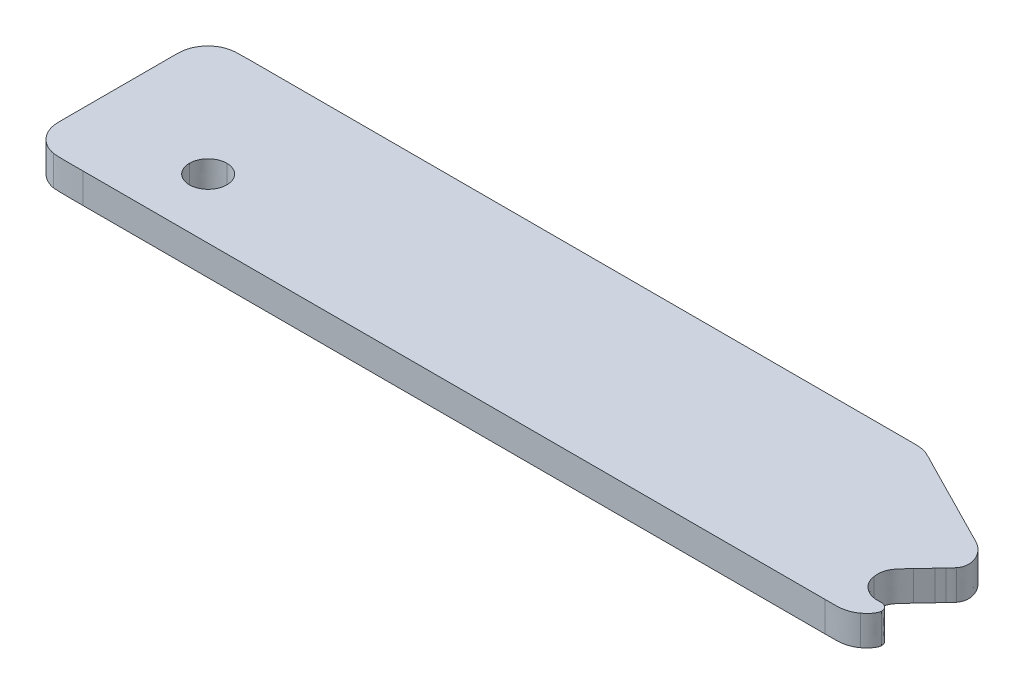
from build123d import *

# Parameters (mm, degrees)
BOSS_EXTRUDE1_DEPTH = 6.35


with BuildPart() as part:
    # Sketch1 → Boss-Extrude1 (new body)
    with BuildSketch(Plane(origin=(0, 0, 0), x_dir=(1, 0, 0), z_dir=(0, 1, 0))):
        with BuildLine():
            add(Edge.make_bspline(
                [(174.840646, 5.6295036), (175.391826, 5.627243), (175.9154724, 5.730748), (176.4597944, 5.4342538)],
                knots=[0, 0, 0, 0, 1, 1, 1, 1], degree=3))
            add(Edge.make_bspline(
                [(176.4597944, 5.4342538), (177.0317008, 5.1242468), (177.2659396, 4.7452534), (177.2866152, 4.0906446)],
                knots=[0, 0, 0, 0, 1, 1, 1, 1], degree=3))
            add(Edge.make_bspline(
                [(177.2866152, 4.0906446), (177.3141234, 3.1260542), (176.0808518, 1.947799), (175.4538274, 1.4862048)],
                knots=[0, 0, 0, 0, 1, 1, 1, 1], degree=3))
            add(Edge.make_bspline(
                [(175.4538274, 1.4862048), (173.407451, -0.0296672), (171.3541658, 0.2390394), (169.1217598, 0.2390394)],
                knots=[0, 0, 0, 0, 1, 1, 1, 1], degree=3))
            add(Edge.make_bspline(
                [(169.1217598, 0.2390394), (164.7602496, 0.2390394), (160.3987648, 0.2390394), (156.0441634, 0.2390394)],
                knots=[0, 0, 0, 0, 1, 1, 1, 1], degree=3))
            add(Edge.make_bspline(
                [(156.0441634, 0.2390394), (147.3211938, 0.2390394), (138.5981988, 0.2390394), (129.8821126, 0.2390394)],
                knots=[0, 0, 0, 0, 1, 1, 1, 1], degree=3))
            add(Edge.make_bspline(
                [(129.8821126, 0.2390394), (112.3879134, 0.2390394), (94.8937142, 0.2390394), (77.3926316, 0.2390394)],
                knots=[0, 0, 0, 0, 1, 1, 1, 1], degree=3))
            add(Edge.make_bspline(
                [(77.3926316, 0.2390394), (59.8846656, 0.2390394), (42.383583, 0.2390394), (24.8755916, 0.2390394)],
                knots=[0, 0, 0, 0, 1, 1, 1, 1], degree=3))
            add(Edge.make_bspline(
                [(24.8755916, 0.2390394), (20.527899, 0.2390394), (16.180181, 0.2390394), (11.8393464, 0.2390394)],
                knots=[0, 0, 0, 0, 1, 1, 1, 1], degree=3))
            add(Edge.make_bspline(
                [(11.8393464, 0.2390394), (11.0194344, 0.2390394), (6.2100714, 0.1990344), (5.3832506, 0.3495548)],
                knots=[0, 0, 0, 0, 1, 1, 1, 1], degree=3))
            add(Edge.make_bspline(
                [(5.3832506, 0.3495548), (3.0681422, 0.7975346), (1.1940032, 2.4785828), (0.5050028, 4.724781)],
                knots=[0, 0, 0, 0, 1, 1, 1, 1], degree=3))
            add(Edge.make_bspline(
                [(0.5050028, 4.724781), (0.1811528, 5.7858914), (0.222504, 6.8331842), (0.222504, 7.9080868)],
                knots=[0, 0, 0, 0, 1, 1, 1, 1], degree=3))
            add(Edge.make_bspline(
                [(0.222504, 7.9080868), (0.222504, 8.9898474), (0.222504, 10.0784914), (0.222504, 11.160252)],
                knots=[0, 0, 0, 0, 1, 1, 1, 1], degree=3))
            add(Edge.make_bspline(
                [(0.222504, 11.160252), (0.222504, 13.33754), (0.222504, 15.5079446), (0.222504, 17.6784)],
                knots=[0, 0, 0, 0, 1, 1, 1, 1], degree=3))
            add(Edge.make_bspline(
                [(0.222504, 17.6784), (0.222504, 22.0260926), (0.222504, 26.3737852), (0.222504, 30.7215032)],
                knots=[0, 0, 0, 0, 1, 1, 1, 1], degree=3))
            add(Edge.make_bspline(
                [(0.222504, 30.7215032), (0.222504, 31.796355), (0.194945, 32.8436986), (0.5325618, 33.9047328)],
                knots=[0, 0, 0, 0, 1, 1, 1, 1], degree=3))
            add(Edge.make_bspline(
                [(0.5325618, 33.9047328), (0.9115044, 35.0691958), (1.5109698, 35.9580434), (2.4411432, 36.7641886)],
                knots=[0, 0, 0, 0, 1, 1, 1, 1], degree=3))
            add(Edge.make_bspline(
                [(2.4411432, 36.7641886), (4.3979592, 38.4453892), (6.42366, 38.2938528), (8.6905338, 38.2938528)],
                knots=[0, 0, 0, 0, 1, 1, 1, 1], degree=3))
            add(Edge.make_bspline(
                [(8.6905338, 38.2938528), (13.0451352, 38.2938528), (17.3997366, 38.2938528), (21.754338, 38.2938528)],
                knots=[0, 0, 0, 0, 1, 1, 1, 1], degree=3))
            add(Edge.make_bspline(
                [(21.754338, 38.2938528), (30.4635408, 38.2938528), (39.1658602, 38.2938528), (47.875063, 38.2938528)],
                knots=[0, 0, 0, 0, 1, 1, 1, 1], degree=3))
            add(Edge.make_bspline(
                [(47.875063, 38.2938528), (65.3623534, 38.2938528), (82.8496692, 38.2938528), (100.3369596, 38.2938528)],
                knots=[0, 0, 0, 0, 1, 1, 1, 1], degree=3))
            add(Edge.make_bspline(
                [(100.3369596, 38.2938528), (109.0875136, 38.2938528), (117.8311588, 38.2938528), (126.5817128, 38.2938528)],
                knots=[0, 0, 0, 0, 1, 1, 1, 1], degree=3))
            add(Edge.make_bspline(
                [(126.5817128, 38.2938528), (130.9569898, 38.2938528), (135.3322414, 38.2938528), (139.7075184, 38.2938528)],
                knots=[0, 0, 0, 0, 1, 1, 1, 1], degree=3))
            add(Edge.make_bspline(
                [(139.7075184, 38.2938528), (141.8917152, 38.2938528), (144.0827954, 38.2938528), (146.2669922, 38.2938528)],
                knots=[0, 0, 0, 0, 1, 1, 1, 1], degree=3))
            add(Edge.make_bspline(
                [(146.2669922, 38.2938528), (147.3625196, 38.2938528), (148.4580724, 38.2938528), (149.5535998, 38.2938528)],
                knots=[0, 0, 0, 0, 1, 1, 1, 1], degree=3))
            add(Edge.make_bspline(
                [(149.5535998, 38.2938528), (150.656036, 38.2938528), (151.717121, 38.2788414), (152.7851148, 37.8733304)],
                knots=[0, 0, 0, 0, 1, 1, 1, 1], degree=3))
            add(Edge.make_bspline(
                [(152.7851148, 37.8733304), (153.8117574, 37.4808496), (154.7419308, 36.9224814), (155.7065466, 36.4264448)],
                knots=[0, 0, 0, 0, 1, 1, 1, 1], degree=3))
            add(Edge.make_bspline(
                [(155.7065466, 36.4264448), (156.6780712, 35.9304336), (157.642687, 35.4411534), (158.6142116, 34.9450406)],
                knots=[0, 0, 0, 0, 1, 1, 1, 1], degree=3))
            add(Edge.make_bspline(
                [(158.6142116, 34.9450406), (160.550352, 33.9597492), (162.4864924, 32.9744324), (164.4226328, 31.989141)],
                knots=[0, 0, 0, 0, 1, 1, 1, 1], degree=3))
            add(Edge.make_bspline(
                [(164.4226328, 31.989141), (166.3587732, 30.9969408), (168.2949136, 30.0116494), (170.2310794, 29.0263326)],
                knots=[0, 0, 0, 0, 1, 1, 1, 1], degree=3))
            add(Edge.make_bspline(
                [(170.2310794, 29.0263326), (171.1956952, 28.5303468), (172.1672198, 28.041092), (173.1318356, 27.5450046)],
                knots=[0, 0, 0, 0, 1, 1, 1, 1], degree=3))
            add(Edge.make_bspline(
                [(173.1318356, 27.5450046), (174.1033602, 27.0554958), (175.0886516, 26.6354306), (175.9223558, 25.8844542)],
                knots=[0, 0, 0, 0, 1, 1, 1, 1], degree=3))
            add(Edge.make_bspline(
                [(175.9223558, 25.8844542), (177.4175522, 24.540845), (178.7404604, 21.9363544), (177.2866152, 20.0208896)],
                knots=[0, 0, 0, 0, 1, 1, 1, 1], degree=3))
            add(Edge.make_bspline(
                [(177.2866152, 20.0208896), (176.9558818, 19.5869052), (176.5631724, 19.2147444), (176.1910878, 18.8219842)],
                knots=[0, 0, 0, 0, 1, 1, 1, 1], degree=3))
            add(Edge.make_bspline(
                [(176.1910878, 18.8219842), (175.8190286, 18.422493), (175.4538274, 18.0227478), (175.0817682, 17.6299876)],
                knots=[0, 0, 0, 0, 1, 1, 1, 1], degree=3))
            add(Edge.make_bspline(
                [(175.0817682, 17.6299876), (174.3445078, 16.8375838), (173.600364, 16.0383474), (172.8562202, 15.2459944)],
                knots=[0, 0, 0, 0, 1, 1, 1, 1], degree=3))
            add(Edge.make_bspline(
                [(172.8562202, 15.2459944), (171.3266322, 13.5992362), (169.7211998, 12.3727464), (170.1346102, 9.6580452)],
                knots=[0, 0, 0, 0, 1, 1, 1, 1], degree=3))
            add(Edge.make_bspline(
                [(170.1346102, 9.6580452), (170.3274978, 8.4177886), (170.823636, 7.549642), (171.7813684, 6.7434968)],
                knots=[0, 0, 0, 0, 1, 1, 1, 1], degree=3))
            add(Edge.make_bspline(
                [(171.7813684, 6.7434968), (172.2361046, 6.3645034), (172.7184252, 6.088888), (173.276514, 5.8960004)],
                knots=[0, 0, 0, 0, 1, 1, 1, 1], degree=3))
            add(Edge.make_bspline(
                [(173.276514, 5.8960004), (173.5383626, 5.8064908), (173.8001858, 5.7375044), (174.0688924, 5.6894984)],
                knots=[0, 0, 0, 0, 1, 1, 1, 1], degree=3))
            add(Edge.make_bspline(
                [(174.0688924, 5.6894984), (174.199804, 5.6694832), (174.330741, 5.6544972), (174.4616526, 5.6394858)],
                knots=[0, 0, 0, 0, 1, 1, 1, 1], degree=3))
            add(Edge.make_bspline(
                [(174.4616526, 5.6394858), (174.5237556, 5.6394858), (174.5925388, 5.634482), (174.6545402, 5.634482)],
                knots=[0, 0, 0, 0, 1, 1, 1, 1], degree=3))
            add(Edge.make_bspline(
                [(174.6545402, 5.634482), (174.6890588, 5.6295036), (174.7166432, 5.6295036), (174.7510602, 5.6295036)],
                knots=[0, 0, 0, 0, 1, 1, 1, 1], degree=3))
            add(Edge.make_bspline(
                [(174.7510602, 5.6295036), (174.7855534, 5.6295036), (174.9094546, 5.634482), (174.840646, 5.6295036)],
                knots=[0, 0, 0, 0, 1, 1, 1, 1], degree=3))
        make_face()
        with BuildLine():
            add(Edge.make_bspline(
                [(29.5953942, 12.9377948), (29.5953942, 10.7466892), (27.817699, 8.9690448), (25.6266188, 8.9690448)],
                knots=[0, 0, 0, 0, 1, 1, 1, 1], degree=3))
            add(Edge.make_bspline(
                [(25.6266188, 8.9690448), (23.4355386, 8.9690448), (21.6578688, 10.7466892), (21.6578688, 12.9377948)],
                knots=[0, 0, 0, 0, 1, 1, 1, 1], degree=3))
            add(Edge.make_bspline(
                [(21.6578688, 12.9377948), (21.6578688, 15.1288496), (23.4355386, 16.9065448), (25.6266188, 16.9065448)],
                knots=[0, 0, 0, 0, 1, 1, 1, 1], degree=3))
            add(Edge.make_bspline(
                [(25.6266188, 16.9065448), (27.817699, 16.9065448), (29.5953942, 15.1288496), (29.5953942, 12.9377948)],
                knots=[0, 0, 0, 0, 1, 1, 1, 1], degree=3))
        make_face(mode=Mode.SUBTRACT)
    extrude(amount=BOSS_EXTRUDE1_DEPTH)


solid = part.part
